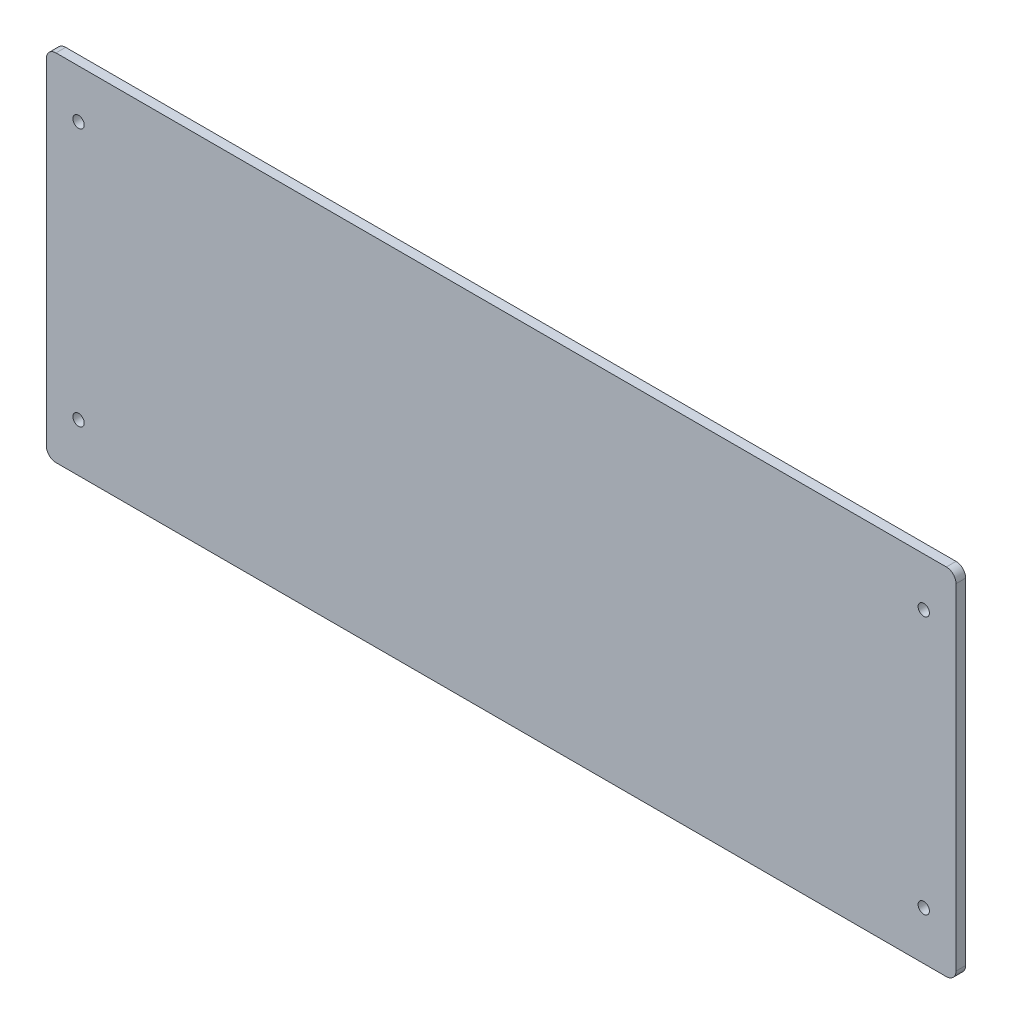
from build123d import *

# Parameters (mm, degrees)
SKETCH1_R           = 1.75
BOSS_EXTRUDE1_DEPTH = 3


with BuildPart() as part:
    # Sketch1 → Boss-Extrude1 (new body)
    with BuildSketch(Plane.XY):
        with BuildLine():
            Line((-138, 334), (138, 334))
            ThreePointArc((138, 334), (140.121320344, 333.121320344), (141, 331))
            Line((141, 331), (141, 227))
            ThreePointArc((141, 227), (140.121320344, 224.878679656), (138, 224))
            Line((138, 224), (-138, 224))
            ThreePointArc((-138, 224), (-140.121320344, 224.878679656), (-141, 227))
            Line((-141, 227), (-141, 331))
            ThreePointArc((-141, 331), (-140.121320344, 333.121320344), (-138, 334))
        make_face()
        with Locations((-131, 319)):
            Circle(SKETCH1_R, mode=Mode.SUBTRACT)
        with Locations((-131, 239)):
            Circle(SKETCH1_R, mode=Mode.SUBTRACT)
        with Locations(Location((131, 239, 0), (0, 0, 180))):
            Circle(SKETCH1_R, mode=Mode.SUBTRACT)
        with Locations(Location((131, 319, 0), (0, 0, 180))):
            Circle(SKETCH1_R, mode=Mode.SUBTRACT)
    extrude(amount=BOSS_EXTRUDE1_DEPTH)


solid = part.part
